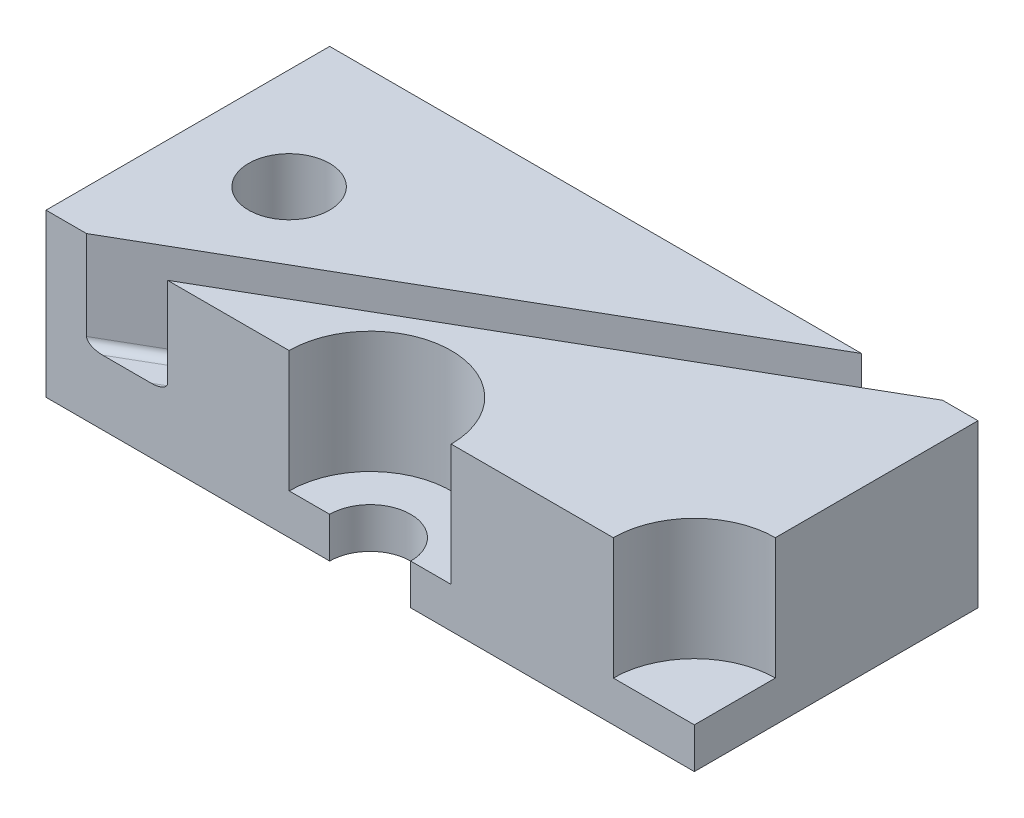
from build123d import *

# Parameters (mm, degrees)
SKETCH1_W           = 203.2
SKETCH1_H           = 50.8
BOSS_EXTRUDE1_DEPTH = 88.9
SKETCH2_R           = 12.7
SKETCH2_R_2         = 25.4
CUT_EXTRUDE1_DEPTH  = 38.1
SKETCH3_R           = 12.7
CUT_EXTRUDE2_DEPTH  = 155.90300195
CUT_EXTRUDE3_DEPTH  = 30.48
FILLET1_R           = 2.54


with BuildPart() as part:
    # Sketch1 → Boss-Extrude1 (new body)
    with BuildSketch(Plane.XY):
        with Locations((19.396363636, 58.871863724)):
            Rectangle(SKETCH1_W, SKETCH1_H)
    extrude(amount=BOSS_EXTRUDE1_DEPTH)

    # Sketch2 → Cut-Extrude1 (cut)
    with BuildSketch(Plane(origin=(0, 84.271863724, 0), x_dir=(1, 0, 0), z_dir=(0, 1, 0))):
        with Locations(Location((-50.453636364, -44.45, 0), (0, 0, 180))):
            Circle(SKETCH2_R)
        with Locations((19.396363636, -88.9)):
            Circle(SKETCH2_R_2)
        with Locations((120.996363636, -88.9)):
            Circle(SKETCH2_R_2)
    extrude(amount=-CUT_EXTRUDE1_DEPTH, mode=Mode.SUBTRACT)

    # Sketch3 → Cut-Extrude2 (cut, through all)
    with BuildSketch(Plane(origin=(0, 46.171863724, 0), x_dir=(1, 0, 0), z_dir=(0, 1, 0))):
        with Locations((19.396363636, -88.9)):
            Circle(SKETCH3_R)
    extrude(amount=-CUT_EXTRUDE2_DEPTH, mode=Mode.SUBTRACT)

    # Sketch4 → Cut-Extrude3 (cut)
    with BuildSketch(Plane(origin=(0, 84.271863724, 0), x_dir=(1, 0, 0), z_dir=(0, 1, 0))):
        Polygon((-69.503636364, -88.9), (84.475680429, 0), (109.875680429, 0), (-44.103636364, -88.9), align=None)
    extrude(amount=-CUT_EXTRUDE3_DEPTH, mode=Mode.SUBTRACT)

    # Fillet1
    fillet1_edges = [part.edges().sort_by_distance(p)[0] for p in [
        (7.486022033, 53.791863724, 44.45),
        (32.886022033, 53.791863724, 44.45),
    ]]
    fillet(fillet1_edges, radius=FILLET1_R)


solid = part.part
